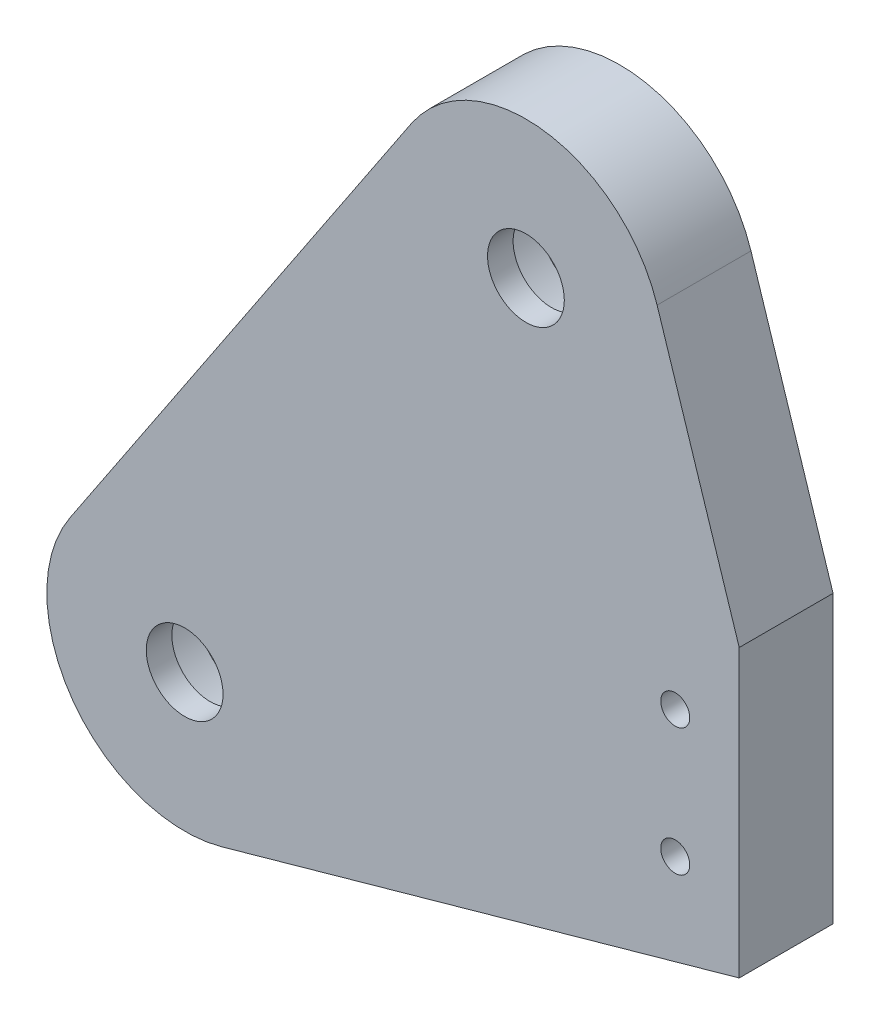
from build123d import *

# Parameters (mm, degrees)
SKETCH1_R           = 11.15
SKETCH1_R_2         = 1.7
BOSS_EXTRUDE1_DEPTH = 8
BOSS_EXTRUDE2_START = 3
SKETCH2_R           = 4.5
SKETCH2_R_2         = 1.7
BOSS_EXTRUDE2_DEPTH = 3


with BuildPart() as part:
    # Sketch1 → Boss-Extrude1 (new body)
    with BuildSketch(Plane.XY):
        with BuildLine():
            Line((65, 1.454102171), (65, 35))
            Line((65, 35), (55.375185128, 64.942285128))
            ThreePointArc((55.375185128, 64.942285128), (42.229542157, 75.995363133), (26.562387746, 68.958408169))
            Line((26.562387746, 68.958408169), (-13.437612254, 8.958408169))
            ThreePointArc((-13.437612254, 8.958408169), (-13.067754119, -9.489799908), (4.360524021, -15.550187467))
            Line((4.360524021, -15.550187467), (65, 1.454102171))
        make_face()
        Circle(SKETCH1_R, mode=Mode.SUBTRACT)
        with Locations((57.5, 24.966666667)):
            Circle(SKETCH1_R_2, mode=Mode.SUBTRACT)
        with Locations((57.5, 10.033333333)):
            Circle(SKETCH1_R_2, mode=Mode.SUBTRACT)
        with Locations((40, 60)):
            Circle(SKETCH1_R, mode=Mode.SUBTRACT)
    extrude(amount=-BOSS_EXTRUDE1_DEPTH)

    # Sketch2 → Boss-Extrude2 (add)
    with BuildSketch(Plane.XY.offset(BOSS_EXTRUDE2_START)):
        with BuildLine():
            Line((4.360524021, -15.550187467), (65, 1.454102171))
            Line((65, 1.454102171), (65, 35))
            Line((65, 35), (55.375185128, 64.942285128))
            ThreePointArc((55.375185128, 64.942285128), (42.229542157, 75.995363133), (26.562387746, 68.958408169))
            Line((26.562387746, 68.958408169), (-13.437612254, 8.958408169))
            ThreePointArc((-13.437612254, 8.958408169), (-13.067754119, -9.489799908), (4.360524021, -15.550187467))
        make_face()
        Circle(SKETCH2_R, mode=Mode.SUBTRACT)
        with Locations((57.5, 24.966666667)):
            Circle(SKETCH2_R_2, mode=Mode.SUBTRACT)
        with Locations((57.5, 10.033333333)):
            Circle(SKETCH2_R_2, mode=Mode.SUBTRACT)
        with Locations((40, 60)):
            Circle(SKETCH2_R, mode=Mode.SUBTRACT)
    extrude(amount=-BOSS_EXTRUDE2_DEPTH)


solid = part.part
